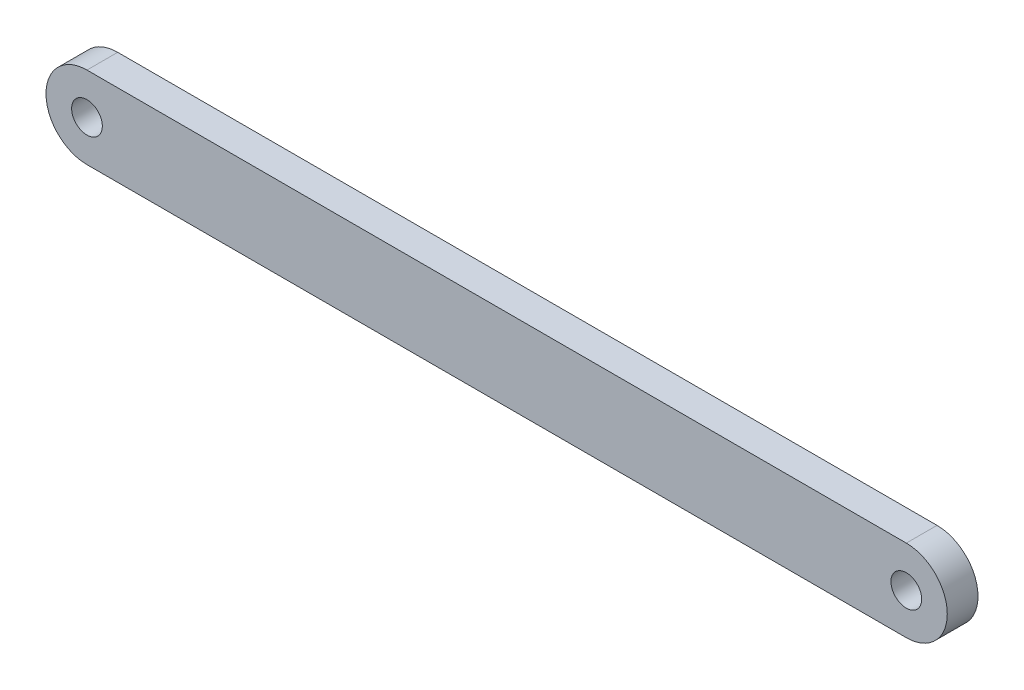
from build123d import *

# Parameters (mm, degrees)
ESQUISSE7_R        = 1.5
BOSS_EXTRU_7_DEPTH = 3


with BuildPart() as part:
    # Esquisse7 → Boss.-Extru.7 (new body)
    with BuildSketch(Plane.XY):
        with BuildLine():
            Line((-65.045038185, -7.584204487), (14.954961815, -7.584204487))
            ThreePointArc((14.954961815, -7.584204487), (18.954961815, -11.584204487), (14.954961815, -15.584204487))
            Line((14.954961815, -15.584204487), (-65.045038185, -15.584204487))
            ThreePointArc((-65.045038185, -15.584204487), (-69.045038185, -11.584204487), (-65.045038185, -7.584204487))
        make_face()
        with Locations((-65.045038185, -11.584204487)):
            Circle(ESQUISSE7_R, mode=Mode.SUBTRACT)
        with Locations((14.954961815, -11.584204487)):
            Circle(ESQUISSE7_R, mode=Mode.SUBTRACT)
    extrude(amount=BOSS_EXTRU_7_DEPTH)


solid = part.part
